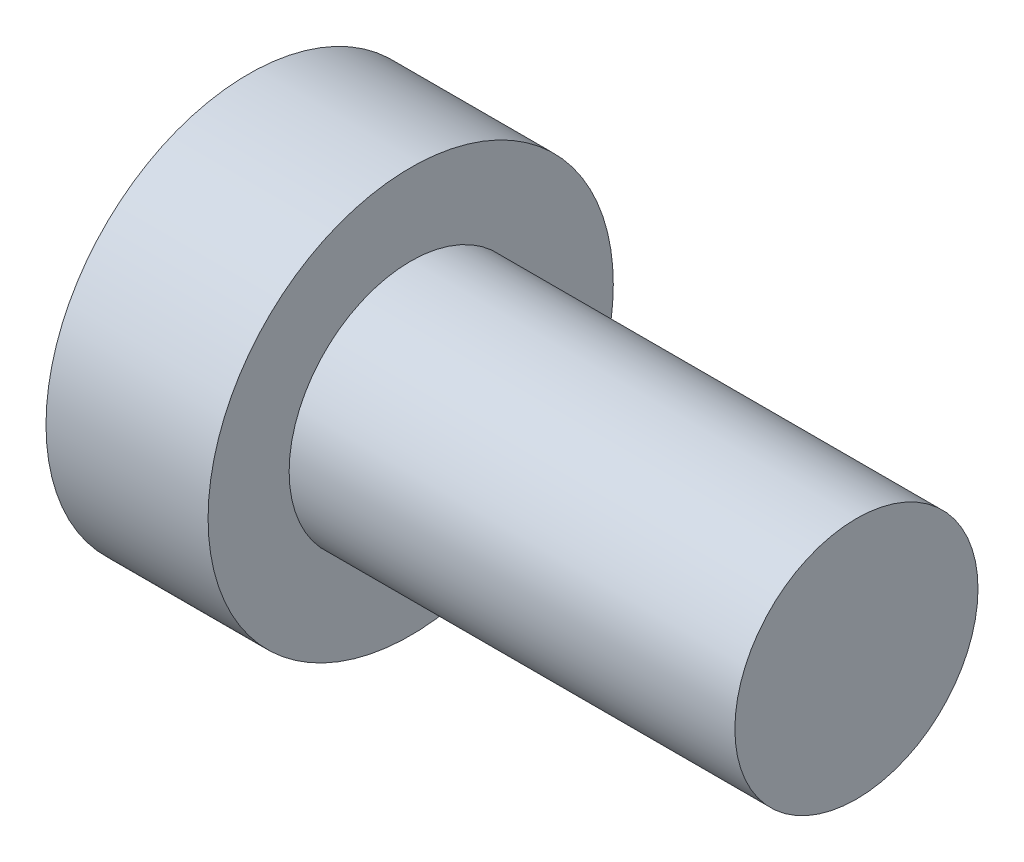
from build123d import *


with BuildPart() as part:
    # Sketch1 → Revolve1 (revolve)
    with BuildSketch(Plane.XY, mode=Mode.PRIVATE) as revolve1_sk:
        Polygon((7.5, 0), (7.5, 1.5), (2, 1.5), (2, 2.5), (0, 2.5), (0, 0), align=None)
    revolve(revolve1_sk.sketch.rotate(Axis((0, 0, 0), (1, 0, 0)), 90), axis=Axis((0, 0, 0), (1, 0, 0)))


solid = part.part
